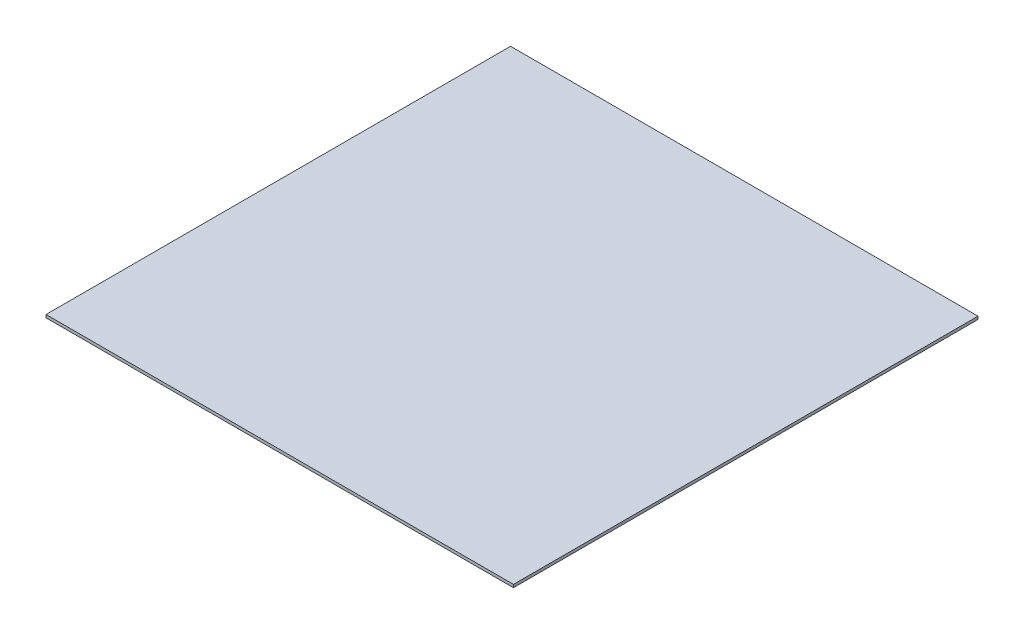
from build123d import *

# Parameters (mm, degrees)
SKETCH1_W           = 805
SKETCH1_H           = 800
BOSS_EXTRUDE1_DEPTH = 5


with BuildPart() as part:
    # Sketch1 → Boss-Extrude1 (new body)
    with BuildSketch(Plane(origin=(0, 0, 0), x_dir=(1, 0, 0), z_dir=(0, 1, 0))):
        Rectangle(SKETCH1_W, SKETCH1_H)
    extrude(amount=BOSS_EXTRUDE1_DEPTH)


solid = part.part
